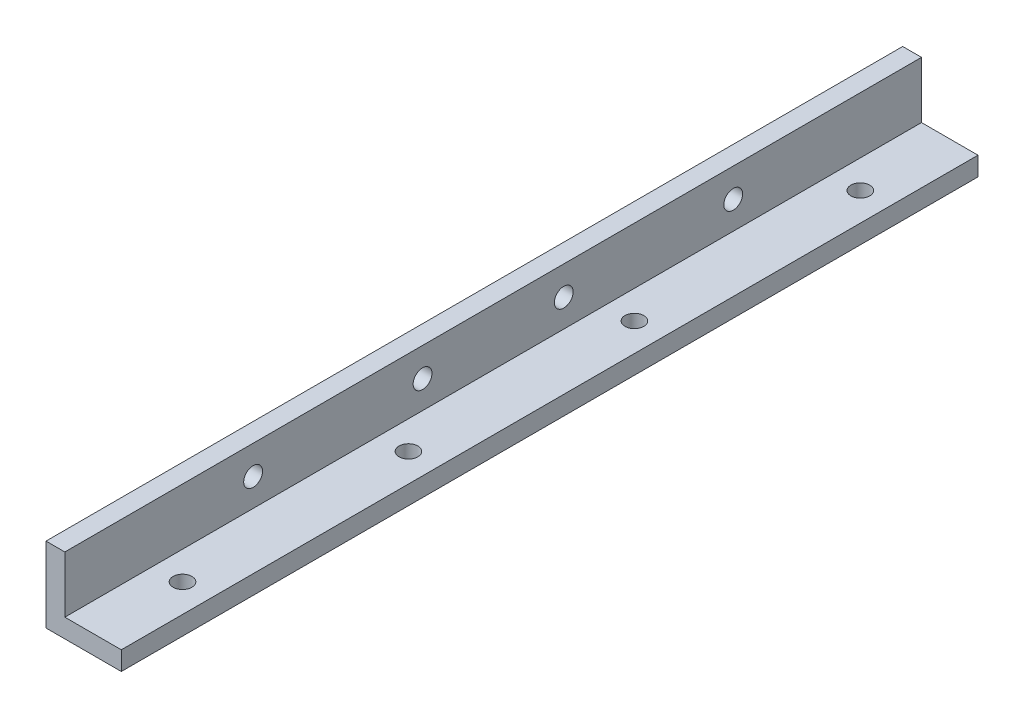
from build123d import *

# Parameters (mm, degrees)
BOSS_EXTRUDE1_DEPTH         = 227.5
TAP_DRILL_FOR_M5X0_8_TAP1_D = 5
F_5_0_5_DIAMETER_HOLE1_D    = 5


with BuildPart() as part:
    # Sketch1 → Boss-Extrude1 (new body)
    with BuildSketch(Plane.XY):
        Polygon((0, 5), (0, 0), (5, 0), (20, 0), (20, 5), (5, 5), (5, 20), (0, 20), align=None)
    extrude(amount=BOSS_EXTRUDE1_DEPTH)

    # Tap Drill for M5x0.8 Tap1 (through all)
    with Locations(Plane(origin=(0, 5, 0), x_dir=(1, 0, 0), z_dir=(0, 1, 0))):
        with Locations((12.5, -203.75), (12.5, -143.75), (12.5, -83.75), (12.5, -23.75)):
            Hole(TAP_DRILL_FOR_M5X0_8_TAP1_D / 2)

    # Ø5.0 (5) Diameter Hole1 (through all)
    with Locations(Plane(origin=(5, 0, 0), x_dir=(0, 0, -1), z_dir=(1, 0, 0))):
        with Locations((-177.5, 12.346163158), (-132.5, 12.346163158), (-95, 12.346163158), (-50, 12.346163158)):
            Hole(F_5_0_5_DIAMETER_HOLE1_D / 2)


solid = part.part
